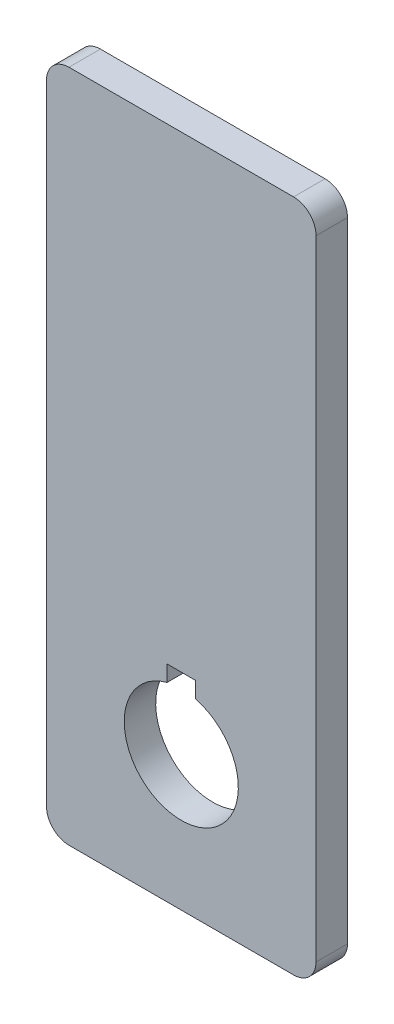
from build123d import *

# Parameters (mm, degrees)
CROQUIS1_R              = 12.7
SALIENTE_EXTRUIR1_DEPTH = 7
CROQUIS2_W              = 6.35
CROQUIS2_H              = 6.35
CORTAR_EXTRUIR1_DEPTH   = 10


with BuildPart() as part:
    # Croquis1 → Saliente-Extruir1 (new body)
    with BuildSketch(Plane.XY):
        with BuildLine():
            Line((-25, -30), (25, -30))
            ThreePointArc((25, -30), (28.535533906, -28.535533906), (30, -25))
            Line((30, -25), (30, 115))
            ThreePointArc((30, 115), (28.535533906, 118.535533906), (25, 120))
            Line((25, 120), (-25, 120))
            ThreePointArc((-25, 120), (-28.535533906, 118.535533906), (-30, 115))
            Line((-30, 115), (-30, -25))
            ThreePointArc((-30, -25), (-28.535533906, -28.535533906), (-25, -30))
        make_face()
        Circle(CROQUIS1_R, mode=Mode.SUBTRACT)
    extrude(amount=SALIENTE_EXTRUIR1_DEPTH)

    # Croquis2 → Cortar-Extruir1 (cut)
    with BuildSketch(Plane.XY.offset(7)):
        with Locations((0, 12.7)):
            Rectangle(CROQUIS2_W, CROQUIS2_H)
    extrude(amount=-CORTAR_EXTRUIR1_DEPTH, mode=Mode.SUBTRACT)


solid = part.part
